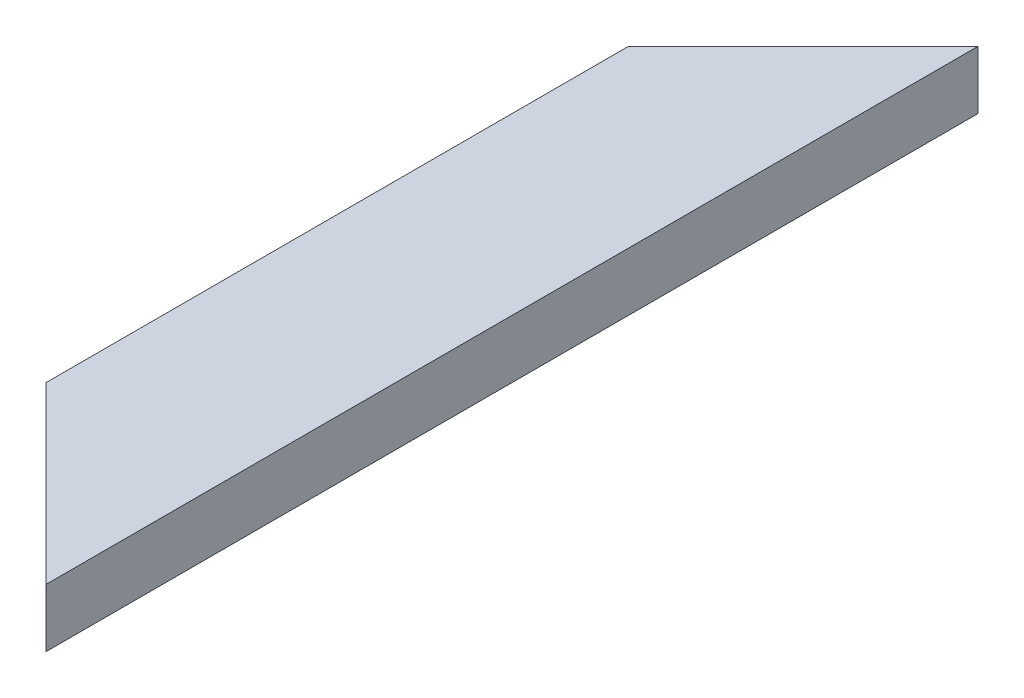
from build123d import *

# Parameters (mm, degrees)
SKETCH1_W           = 152.4
SKETCH1_H           = 50.8
BOSS_EXTRUDE1_DEPTH = 812.8
CUT_EXTRUDE1_DEPTH  = 711.2


with BuildPart() as part:
    # Sketch1 → Boss-Extrude1 (new body)
    with BuildSketch(Plane.XY):
        with Locations((76.2, -25.4)):
            Rectangle(SKETCH1_W, SKETCH1_H)
    extrude(amount=BOSS_EXTRUDE1_DEPTH)

    # Sketch2 → Cut-Extrude1 (cut)
    with BuildSketch(Plane(origin=(0, 0, 0), x_dir=(1, 0, 0), z_dir=(0, 1, 0))):
        Polygon((152.4, 0), (0, -152.4), (0, 0), align=None)
        Polygon((152.4, -812.8), (0, -660.4), (0, -812.8), align=None)
    extrude(amount=-CUT_EXTRUDE1_DEPTH, mode=Mode.SUBTRACT)


solid = part.part
